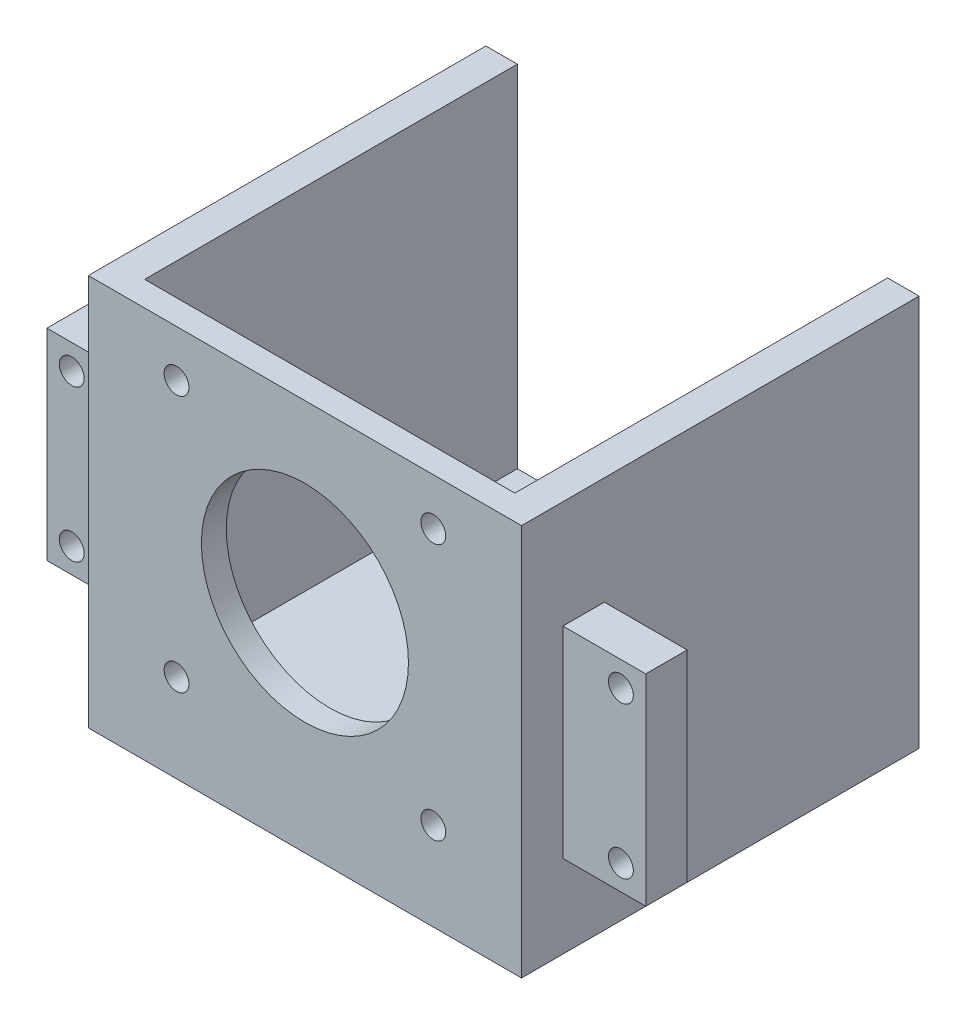
from build123d import *

# Parameters (mm, degrees)
SKETCH_1_W          = 42.3
SKETCH_1_H          = 42.3
EXTRUDE_1_DEPTH     = 3
SKETCH_2_R          = 1.5
CUT_EXTRUDE_1_DEPTH = 3
SKETCH_3_R          = 12.5
CUT_EXTRUDE_2_DEPTH = 3
EXTRUDE_2_DEPTH     = 48
SKETCH_5_W          = 5
SKETCH_5_H          = 47.3
EXTRUDE_3_DEPTH     = 10
SKETCH_6_W          = 5
SKETCH_6_H          = 47.3
EXTRUDE_4_DEPTH     = 10
SKETCH_7_R          = 1.5
CUT_EXTRUDE_3_DEPTH = 10
SKETCH_8_W          = 44.7
SKETCH_8_H          = 45
CUT_EXTRUDE_4_DEPTH = 42.3
SKETCH_10_W         = 10
SKETCH_10_H         = 13
SKETCH_10_H_2       = 10
CUT_EXTRUDE_5_DEPTH = 10


with BuildPart() as part:
    # 草图1 → 凸台-拉伸1 (new body)
    with BuildSketch(Plane.XY):
        Rectangle(SKETCH_1_W, SKETCH_1_H)
    extrude(amount=EXTRUDE_1_DEPTH)

    # 草图2 → 切除-拉伸1 (cut)
    with BuildSketch(Plane.XY.offset(3)):
        with Locations((-15.5, 15.5)):
            Circle(SKETCH_2_R)
        with Locations((15.5, 15.5)):
            Circle(SKETCH_2_R)
        with Locations((15.5, -15.5)):
            Circle(SKETCH_2_R)
        with Locations((-15.5, -15.5)):
            Circle(SKETCH_2_R)
    extrude(amount=-CUT_EXTRUDE_1_DEPTH, mode=Mode.SUBTRACT)

    # 草图3 → 切除-拉伸2 (cut)
    with BuildSketch(Plane.XY.offset(3)):
        Circle(SKETCH_3_R)
    extrude(amount=-CUT_EXTRUDE_2_DEPTH, mode=Mode.SUBTRACT)

    # 草图4 → 凸台-拉伸2 (add)
    with BuildSketch(Plane.XY.offset(3)):
        Polygon((-26.15, -26.15), (26.15, -26.15), (26.15, 21.15), (21.15, 21.15), (21.15, -21.15), (-21.15, -21.15), (-21.15, 21.15), (-26.15, 21.15), align=None)
    extrude(amount=-EXTRUDE_2_DEPTH)

    # 草图5 → 凸台-拉伸3 (add)
    with BuildSketch(Plane.ZY.offset(26.15)):
        with Locations((-4.5, -2.5)):
            Rectangle(SKETCH_5_W, SKETCH_5_H)
    extrude(amount=EXTRUDE_3_DEPTH)

    # 草图6 → 凸台-拉伸4 (add)
    with BuildSketch(Plane(origin=(26.15, 0, 0), x_dir=(0, 0, -1), z_dir=(1, 0, 0))):
        with Locations((4.5, -2.5)):
            Rectangle(SKETCH_6_W, SKETCH_6_H)
    extrude(amount=EXTRUDE_4_DEPTH)

    # 草图7 → 切除-拉伸3 (cut)
    with BuildSketch(Plane.XY.offset(3)):
        with Locations((-33.15, -13.15)):
            Circle(SKETCH_7_R)
        with Locations((-33.15, 5.15)):
            Circle(SKETCH_7_R)
        with Locations(Location((33.15, -13.15, 0), (0, 0, 180))):
            Circle(SKETCH_7_R)
        with Locations(Location((33.15, 5.15, 0), (0, 0, 180))):
            Circle(SKETCH_7_R)
    extrude(amount=-CUT_EXTRUDE_3_DEPTH, mode=Mode.SUBTRACT)

    # 草图8 → 切除-拉伸4 (cut)
    with BuildSketch(Plane(origin=(0, 21.15, 0), x_dir=(1, 0, 0), z_dir=(0, 1, 0))):
        with Locations((0, 22.5)):
            Rectangle(SKETCH_8_W, SKETCH_8_H)
    extrude(amount=-CUT_EXTRUDE_4_DEPTH, mode=Mode.SUBTRACT)

    # 草图10 → 切除-拉伸5 (cut)
    with BuildSketch(Plane.XY.offset(-2)):
        with Locations((-31.15, 14.65)):
            Rectangle(SKETCH_10_W, SKETCH_10_H)
        with Locations((31.15, 14.65)):
            Rectangle(SKETCH_10_W, SKETCH_10_H)
        with Locations((-31.15, -21.15)):
            Rectangle(SKETCH_10_W, SKETCH_10_H_2)
        with Locations((31.15, -21.15)):
            Rectangle(SKETCH_10_W, SKETCH_10_H_2)
    extrude(amount=-CUT_EXTRUDE_5_DEPTH, mode=Mode.SUBTRACT)


solid = part.part
